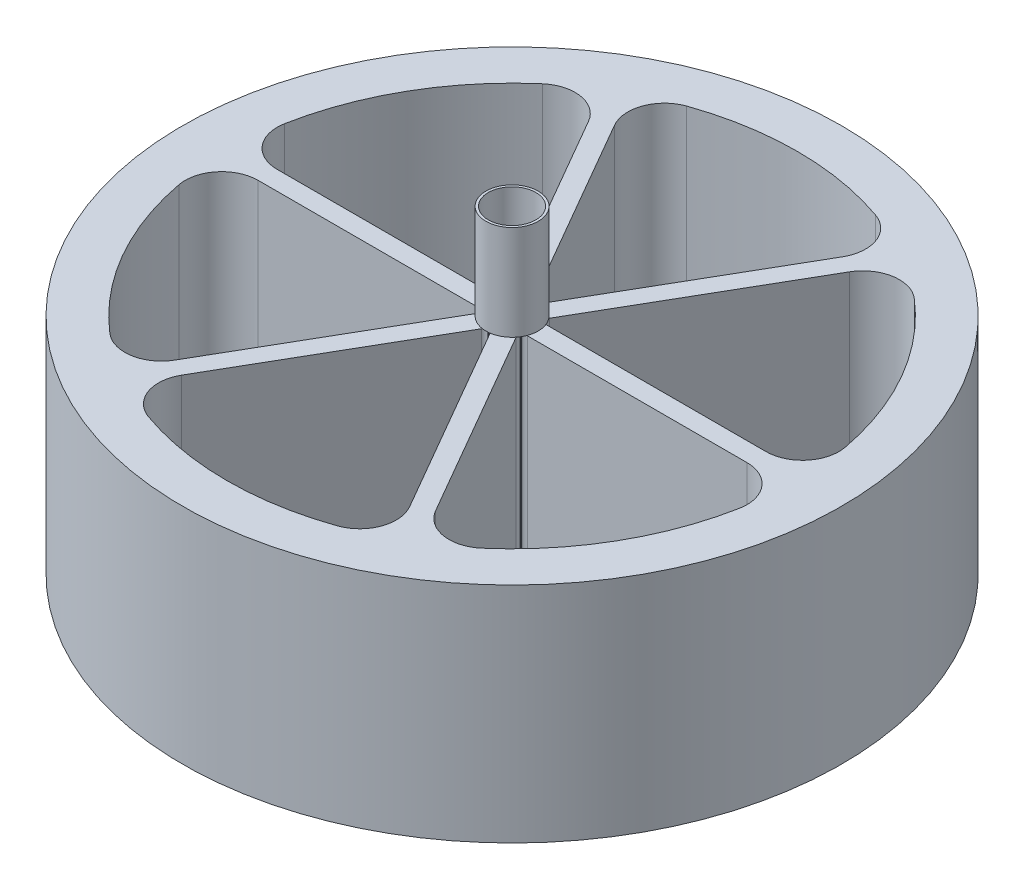
from build123d import *

# Parameters (mm, degrees)
SKETCH1_R             = 2.75
SKETCH1_R_2           = 2.5
BOSS_EXTRUDE1_DEPTH   = 10
BOSS_EXTRUDE3_DEPTH   = 23.5
BOSS_EXTRUDE3_2_DEPTH = 23.5
BOSS_EXTRUDE3_3_DEPTH = 23.5
BOSS_EXTRUDE3_4_DEPTH = 23.5
BOSS_EXTRUDE3_5_DEPTH = 23.5
BOSS_EXTRUDE3_6_DEPTH = 23.5
SKETCH5_R             = 34.666608733
SKETCH5_R_2           = 30
BOSS_EXTRUDE4_DEPTH   = 23.5
SKETCH6_R             = 1.5
BOSS_EXTRUDE5_DEPTH   = 28
SKETCH7_R             = 2.25
CUT_EXTRUDE1_DEPTH    = 28


with BuildPart() as part:
    # Sketch1 → Boss-Extrude1 (new body)
    with BuildSketch(Plane(origin=(0, 0, 0), x_dir=(1, 0, 0), z_dir=(0, 1, 0))):
        with Locations(Location((0, 0, 0), (0, 0, 270))):
            Circle(SKETCH1_R)
        with Locations(Location((0, 0, 0), (0, 0, 270))):
            Circle(SKETCH1_R_2, mode=Mode.SUBTRACT)
    extrude(amount=BOSS_EXTRUDE1_DEPTH)


with BuildPart() as body_2:
    # Sketch2 → Boss-Extrude3 (new body)
    with BuildSketch(Plane(origin=(0, 0, 0), x_dir=(-1, 0, 0), z_dir=(0, -1, 0))):
        with BuildLine():
            Line((2.61395079, 1), (25.707973339, 1))
            ThreePointArc((25.707973339, 1), (28.664062792, 2.388870469), (29.481986287, 5.550899437))
            ThreePointArc((29.481986287, 5.550899437), (30, 0), (29.481986287, -5.550899437))
            ThreePointArc((29.481986287, -5.550899437), (28.664062792, -2.388870469), (25.707973339, -1))
            Line((25.707973339, -1), (2.61395079, -1))
            ThreePointArc((2.61395079, -1), (2.399550586, -1.045528996), (2.222154945, -1.174257873))
            Line((2.222154945, -1.174257873), (2.178514499, -1.226407182))
            ThreePointArc((2.178514499, -1.226407182), (2.499969191, -0.012411485), (2.190584188, 1.204716114))
            Line((2.190584188, 1.204716114), (2.222154945, 1.174257873))
            ThreePointArc((2.222154945, 1.174257873), (2.399550586, 1.045528996), (2.61395079, 1))
        make_face()
    extrude(amount=BOSS_EXTRUDE3_DEPTH)



with BuildPart() as body_3:
    # Sketch2 → Boss-Extrude3 2 (new body)
    with BuildSketch(Plane(origin=(0, 0, 0), x_dir=(-1, 0, 0), z_dir=(0, -1, 0))):
        with BuildLine():
            Line((0.440949991, -2.763747789), (11.987961266, -22.763757991))
            ThreePointArc((11.987961266, -22.763757991), (12.263208883, -26.018241788), (9.933773217, -28.307598797))
            ThreePointArc((9.933773217, -28.307598797), (15, -25.980762114), (19.54821307, -22.75669936))
            ThreePointArc((19.54821307, -22.75669936), (16.400853909, -23.629371319), (13.720012073, -21.763757991))
            Line((13.720012073, -21.763757991), (2.173000799, -1.763747789))
            ThreePointArc((2.173000799, -1.763747789), (2.105229964, -1.555307267), (2.128014621, -1.337313697))
            Line((2.128014621, -1.337313697), (2.138606853, -1.294743499))
            ThreePointArc((2.138606853, -1.294743499), (1.239235934, -2.17124257), (0.027157474, -2.49985249))
            Line((0.027157474, -2.49985249), (0.094140324, -2.511571571))
            ThreePointArc((0.094140324, -2.511571571), (0.294320622, -2.600836263), (0.440949991, -2.763747789))
        make_face()
    extrude(amount=BOSS_EXTRUDE3_2_DEPTH)


with BuildPart() as body_4:
    # Sketch2 → Boss-Extrude3 3 (new body)
    with BuildSketch(Plane(origin=(0, 0, 0), x_dir=(-1, 0, 0), z_dir=(0, -1, 0))):
        with BuildLine():
            Line((-2.173000799, -1.763747789), (-13.720012073, -21.763757991))
            ThreePointArc((-13.720012073, -21.763757991), (-16.400853909, -23.629371319), (-19.54821307, -22.75669936))
            ThreePointArc((-19.54821307, -22.75669936), (-15, -25.980762114), (-9.933773217, -28.307598797))
            ThreePointArc((-9.933773217, -28.307598797), (-12.263208883, -26.018241788), (-11.987961266, -22.763757991))
            Line((-11.987961266, -22.763757991), (-0.440949991, -2.763747789))
            ThreePointArc((-0.440949991, -2.763747789), (-0.294320622, -2.600836263), (-0.094140324, -2.511571571))
            Line((-0.094140324, -2.511571571), (-0.051977335, -2.499459613))
            ThreePointArc((-0.051977335, -2.499459613), (-1.260733257, -2.158831086), (-2.151357025, -1.273445308))
            Line((-2.151357025, -1.273445308), (-2.128014621, -1.337313697))
            ThreePointArc((-2.128014621, -1.337313697), (-2.105229964, -1.555307267), (-2.173000799, -1.763747789))
        make_face()
    extrude(amount=BOSS_EXTRUDE3_3_DEPTH)


with BuildPart() as body_5:
    # Sketch2 → Boss-Extrude3 4 (new body)
    with BuildSketch(Plane(origin=(0, 0, 0), x_dir=(-1, 0, 0), z_dir=(0, -1, 0))):
        with BuildLine():
            Line((-2.61395079, 1), (-25.707973339, 1))
            ThreePointArc((-25.707973339, 1), (-28.664062792, 2.388870469), (-29.481986287, 5.550899437))
            ThreePointArc((-29.481986287, 5.550899437), (-30, 0), (-29.481986287, -5.550899437))
            ThreePointArc((-29.481986287, -5.550899437), (-28.664062792, -2.388870469), (-25.707973339, -1))
            Line((-25.707973339, -1), (-2.61395079, -1))
            ThreePointArc((-2.61395079, -1), (-2.399550586, -1.045528996), (-2.222154945, -1.174257873))
            Line((-2.222154945, -1.174257873), (-2.190584188, -1.204716114))
            ThreePointArc((-2.190584188, -1.204716114), (-2.499969191, 0.012411485), (-2.178514499, 1.226407182))
            Line((-2.178514499, 1.226407182), (-2.222154945, 1.174257873))
            ThreePointArc((-2.222154945, 1.174257873), (-2.399550586, 1.045528996), (-2.61395079, 1))
        make_face()
    extrude(amount=BOSS_EXTRUDE3_4_DEPTH)


with BuildPart() as body_6:
    # Sketch2 → Boss-Extrude3 5 (new body)
    with BuildSketch(Plane(origin=(0, 0, 0), x_dir=(-1, 0, 0), z_dir=(0, -1, 0))):
        with BuildLine():
            Line((-0.440949991, 2.763747789), (-11.987961266, 22.763757991))
            ThreePointArc((-11.987961266, 22.763757991), (-12.263208883, 26.018241788), (-9.933773217, 28.307598797))
            ThreePointArc((-9.933773217, 28.307598797), (-15, 25.980762114), (-19.54821307, 22.75669936))
            ThreePointArc((-19.54821307, 22.75669936), (-16.400853909, 23.629371319), (-13.720012073, 21.763757991))
            Line((-13.720012073, 21.763757991), (-2.173000799, 1.763747789))
            ThreePointArc((-2.173000799, 1.763747789), (-2.105229964, 1.555307267), (-2.128014621, 1.337313697))
            Line((-2.128014621, 1.337313697), (-2.138606853, 1.294743499))
            ThreePointArc((-2.138606853, 1.294743499), (-1.239235934, 2.17124257), (-0.027157474, 2.49985249))
            Line((-0.027157474, 2.49985249), (-0.094140324, 2.511571571))
            ThreePointArc((-0.094140324, 2.511571571), (-0.294320622, 2.600836263), (-0.440949991, 2.763747789))
        make_face()
    extrude(amount=BOSS_EXTRUDE3_5_DEPTH)


with BuildPart() as body_7:
    # Sketch2 → Boss-Extrude3 6 (new body)
    with BuildSketch(Plane(origin=(0, 0, 0), x_dir=(-1, 0, 0), z_dir=(0, -1, 0))):
        with BuildLine():
            Line((2.173000799, 1.763747789), (13.720012073, 21.763757991))
            ThreePointArc((13.720012073, 21.763757991), (16.400853909, 23.629371319), (19.54821307, 22.75669936))
            ThreePointArc((19.54821307, 22.75669936), (15, 25.980762114), (9.933773217, 28.307598797))
            ThreePointArc((9.933773217, 28.307598797), (12.263208883, 26.018241788), (11.987961266, 22.763757991))
            Line((11.987961266, 22.763757991), (0.440949991, 2.763747789))
            ThreePointArc((0.440949991, 2.763747789), (0.294320622, 2.600836263), (0.094140324, 2.511571571))
            Line((0.094140324, 2.511571571), (0.051977335, 2.499459613))
            ThreePointArc((0.051977335, 2.499459613), (1.260733257, 2.158831086), (2.151357025, 1.273445308))
            Line((2.151357025, 1.273445308), (2.128014621, 1.337313697))
            ThreePointArc((2.128014621, 1.337313697), (2.105229964, 1.555307267), (2.173000799, 1.763747789))
        make_face()
    extrude(amount=BOSS_EXTRUDE3_6_DEPTH)


with BuildPart() as body_2_1:
    add(body_2.part)

    add(body_3.part)  # Boss-Extrude4 merges body 3

    add(body_4.part)  # Boss-Extrude4 merges body 4

    add(body_5.part)  # Boss-Extrude4 merges body 5

    add(body_6.part)  # Boss-Extrude4 merges body 6

    add(body_7.part)  # Boss-Extrude4 merges body 7
    # Sketch5 → Boss-Extrude4 (add)
    with BuildSketch(Plane(origin=(0, -23.5, 0), x_dir=(-1, 0, 0), z_dir=(0, -1, 0))):
        with Locations(Location((0, 0, 0), (0, 0, 90))):
            Circle(SKETCH5_R)
        Circle(SKETCH5_R_2, mode=Mode.SUBTRACT)
    extrude(amount=-BOSS_EXTRUDE4_DEPTH)


with BuildPart() as body_3_2:
    # Sketch6 → Boss-Extrude5 (new body)
    with BuildSketch(Plane(origin=(0, 10, 0), x_dir=(1, 0, 0), z_dir=(0, 1, 0))):
        with Locations(Location((0, 0, 0), (0, 0, 270))):
            Circle(SKETCH6_R)
    extrude(amount=-BOSS_EXTRUDE5_DEPTH)

    # Sketch7 → Cut-Extrude1 (cut)
    with BuildSketch(Plane(origin=(0, 10, 0), x_dir=(1, 0, 0), z_dir=(0, 1, 0))):
        Circle(SKETCH7_R)
    extrude(amount=-CUT_EXTRUDE1_DEPTH, mode=Mode.SUBTRACT)


solid = Compound([part.part, body_2_1.part])
